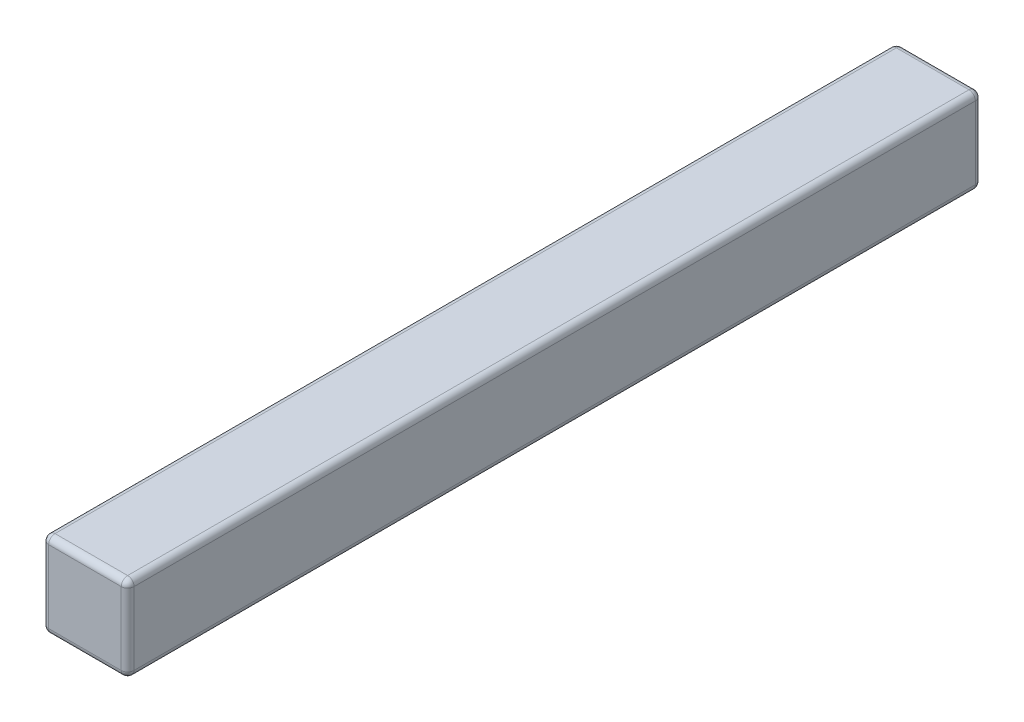
from build123d import *

# Parameters (mm, degrees)
BOSS_EXTRUDE1_DEPTH      = 10
BOSS_EXTRUDE1_DEPTH_BACK = 10
SKETCH3_W                = 2
SKETCH3_H                = 2
FILLET2_R                = 0.15


with BuildPart() as part:
    # Sketch3 → Boss-Extrude1 (new, two sides: drawn at the far end of the back side and taken through both)
    with BuildSketch(Plane.XY.offset(-BOSS_EXTRUDE1_DEPTH_BACK)):
        Rectangle(SKETCH3_W, SKETCH3_H)
    extrude(amount=BOSS_EXTRUDE1_DEPTH + BOSS_EXTRUDE1_DEPTH_BACK)

    # Fillet2
    fillet2_edges = [part.edges().sort_by_distance(p)[0] for p in [
        (0, 1, 10),
        (0, -1, -10),
        (-1, 0, -10),
        (0, 1, -10),
        (1, 0, -10),
        (-1, 0, 10),
        (0, -1, 10),
        (1, 0, 10),
        (-1, -1, 0),
        (-1, 1, 0),
        (1, 1, 0),
        (1, -1, 0),
    ]]
    fillet(fillet2_edges, radius=FILLET2_R)


solid = part.part
